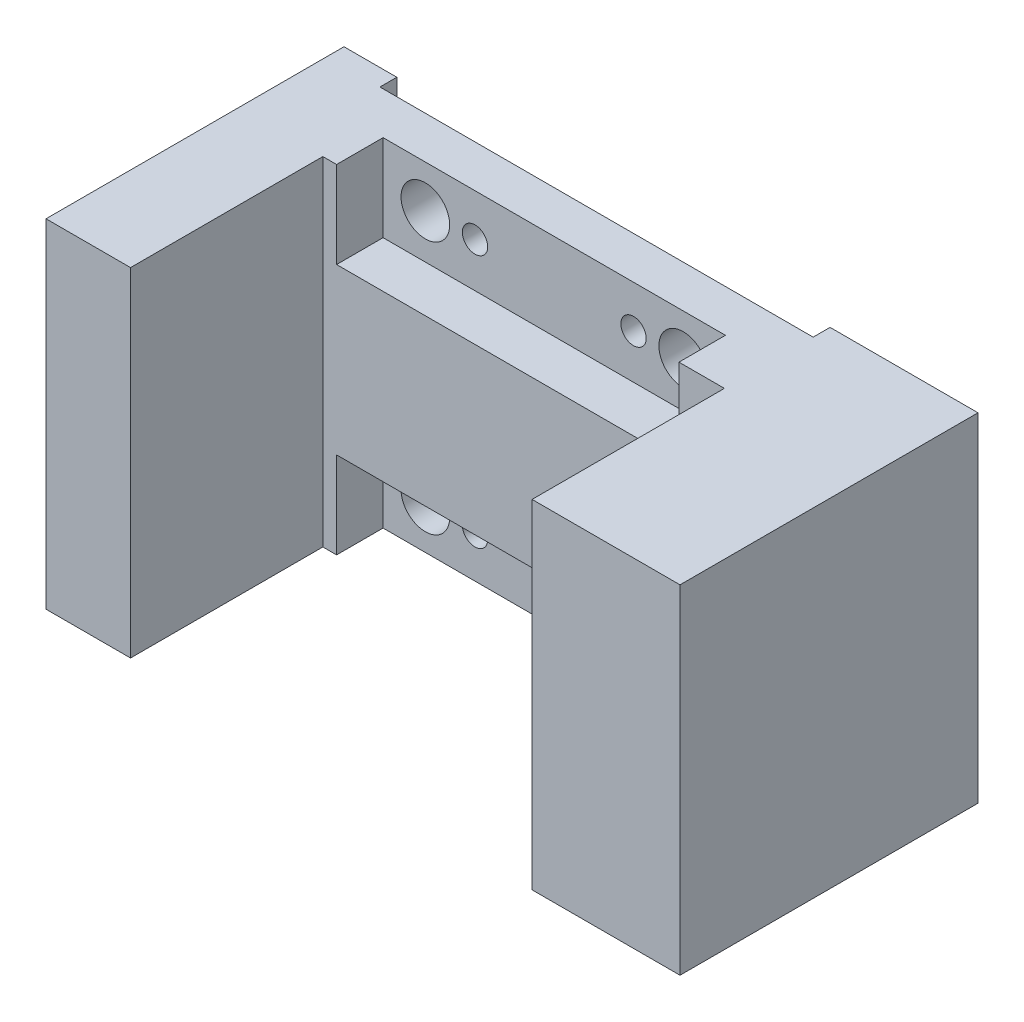
from build123d import *

# Parameters (mm, degrees)
SKETCH_1_W           = 30
SKETCH_1_H           = 28
EXTRUDE_1_DEPTH      = 10
CUT_EXTRUDE_2_DEPTH  = 0.8
M1_4X0_3_2_D         = 1.1
M1_4X0_3_2_DEPTH     = 3.7
M1_4X0_3_2_TIP       = 0.33047334
SKETCH_12_W          = 30
SKETCH_12_H          = 4.25
CUT_EXTRUDE_5_DEPTH  = 10
SKETCH_14_W          = 23
SKETCH_14_H          = 23.75
CUT_EXTRUDE_7_DEPTH  = 5
SKETCH_23_W          = 4
SKETCH_23_H          = 23.75
EXTRUDE_4_DEPTH      = 9.1
SKETCH_31_W          = 7
SKETCH_31_H          = 23.75
EXTRUDE_6_DEPTH      = 4.1
SKETCH_32_W          = 30
SKETCH_32_H          = 7.75
CUT_EXTRUDE_13_DEPTH = 20
SKETCH_33_W          = 3
SKETCH_33_H          = 0.8
CUT_EXTRUDE_14_DEPTH = 10
SKETCH_24_W          = 16.2
SKETCH_24_H          = 4.1
CUT_EXTRUDE_10_DEPTH = 5
SKETCH_29_W          = 16.2
SKETCH_29_H          = 2
EXTRUDE_5_DEPTH      = 4.1
SKETCH_35_W          = 16.2
SKETCH_35_H          = 2
EXTRUDE_7_DEPTH      = 4.1
SKETCH_30_R          = 1.15
SKETCH_30_R_2        = 0.6
CUT_EXTRUDE_12_DEPTH = 5


with BuildPart() as part:
    # 草图1 → 凸台-拉伸1 (new body)
    with BuildSketch(Plane.XY):
        with Locations((7.449728974, 2.736434109)):
            Rectangle(SKETCH_1_W, SKETCH_1_H)
    extrude(amount=EXTRUDE_1_DEPTH)

    # 草图2 → 切除-拉伸2 (cut)
    with BuildSketch(Plane(origin=(0, 0, 0), x_dir=(-1, 0, 0), z_dir=(0, 0, -1))):
        with BuildLine():
            Line((5.050271026, 16.736434109), (-15.449728974, 16.736434109))
            Line((-15.449728974, 16.736434109), (-15.449728974, 3.736434109))
            ThreePointArc((-15.449728974, 3.736434109), (-14.571049317, 1.615113765), (-12.449728974, 0.736434109))
            Line((-12.449728974, 0.736434109), (2.050271026, 0.736434109))
            ThreePointArc((2.050271026, 0.736434109), (4.17159137, 1.615113765), (5.050271026, 3.736434109))
            Line((5.050271026, 3.736434109), (5.050271026, 16.736434109))
        make_face()
    extrude(amount=-CUT_EXTRUDE_2_DEPTH, mode=Mode.SUBTRACT)

    # M1.4x0.3 螺纹孔2
    with Locations(Plane(origin=(0, 0, 0.8), x_dir=(-1, 0, 0), z_dir=(0, 0, -1))):
        with Locations((-12.199728974, 8.736434109), (1.800271026, 8.736434109)):
            Hole(M1_4X0_3_2_D / 2, depth=M1_4X0_3_2_DEPTH)
            with Locations((0, 0, -(M1_4X0_3_2_DEPTH + M1_4X0_3_2_TIP / 2))):  # 118° drill point
                Cone(0, M1_4X0_3_2_D / 2, M1_4X0_3_2_TIP, mode=Mode.SUBTRACT)

    # 草图12 → 切除-拉伸5 (cut)
    with BuildSketch(Plane(origin=(0, 0, 0), x_dir=(-1, 0, 0), z_dir=(0, 0, -1))):
        with Locations((-7.449728974, -9.138565891)):
            Rectangle(SKETCH_12_W, SKETCH_12_H)
    extrude(amount=-CUT_EXTRUDE_5_DEPTH, mode=Mode.SUBTRACT)

    # 草图14 → 切除-拉伸7 (cut)
    with BuildSketch(Plane.XY.offset(10)):
        with Locations((3.949728974, 4.861434109)):
            Rectangle(SKETCH_14_W, SKETCH_14_H)
    extrude(amount=-CUT_EXTRUDE_7_DEPTH, mode=Mode.SUBTRACT)

    # 草图23 → 凸台-拉伸4 (add)
    with BuildSketch(Plane.XY.offset(5)):
        with Locations((-5.550271026, 4.861434109)):
            Rectangle(SKETCH_23_W, SKETCH_23_H)
    extrude(amount=EXTRUDE_4_DEPTH)

    # 草图31 → 凸台-拉伸6 (add)
    with BuildSketch(Plane.XY.offset(10)):
        with Locations((18.949728974, 4.861434109)):
            Rectangle(SKETCH_31_W, SKETCH_31_H)
    extrude(amount=EXTRUDE_6_DEPTH)

    # 草图32 → 切除-拉伸13 (cut)
    with BuildSketch(Plane(origin=(0, 0, 0), x_dir=(-1, 0, 0), z_dir=(0, 0, -1))):
        with Locations((-7.449728974, -3.138565891)):
            Rectangle(SKETCH_32_W, SKETCH_32_H)
    extrude(amount=-CUT_EXTRUDE_13_DEPTH, mode=Mode.SUBTRACT)

    # 草图33 → 切除-拉伸14 (cut)
    with BuildSketch(Plane.XZ.offset(-0.736434109)):
        with Locations((-3.550271026, 0.4)):
            Rectangle(SKETCH_33_W, SKETCH_33_H)
        with Locations((13.949728974, 0.4)):
            Rectangle(SKETCH_33_W, SKETCH_33_H)
    extrude(amount=-CUT_EXTRUDE_14_DEPTH, mode=Mode.SUBTRACT)

    # 草图24 → 切除-拉伸10 (cut)
    with BuildSketch(Plane(origin=(0, 0, 0.8), x_dir=(-1, 0, 0), z_dir=(0, 0, -1))):
        with Locations((-5.199728974, 14.686434109)):
            Rectangle(SKETCH_24_W, SKETCH_24_H)
        with Locations((-5.199728974, 2.786434109)):
            Rectangle(SKETCH_24_W, SKETCH_24_H)
    extrude(amount=-CUT_EXTRUDE_10_DEPTH, mode=Mode.SUBTRACT)

    # 草图29 → 凸台-拉伸5 (add)
    with BuildSketch(Plane(origin=(0, 12.636434109, 0), x_dir=(1, 0, 0), z_dir=(0, 1, 0))):
        with Locations((5.199728974, -1.8)):
            Rectangle(SKETCH_29_W, SKETCH_29_H)
    extrude(amount=EXTRUDE_5_DEPTH)

    # 草图35 → 凸台-拉伸7 (add)
    with BuildSketch(Plane.XZ.offset(-4.836434109)):
        with Locations((5.199728974, 1.8)):
            Rectangle(SKETCH_35_W, SKETCH_35_H)
    extrude(amount=EXTRUDE_7_DEPTH)

    # 草图30 → 切除-拉伸12 (cut)
    with BuildSketch(Plane(origin=(0, 0, 0.8), x_dir=(-1, 0, 0), z_dir=(0, 0, -1))):
        with Locations((0.900271026, 14.736434109)):
            Circle(SKETCH_30_R)
        with Locations((-11.299728974, 14.736434109)):
            Circle(SKETCH_30_R)
        with Locations((-8.949728974, 2.736434109)):
            Circle(SKETCH_30_R_2)
        with Locations((-1.449728974, 14.736434109)):
            Circle(SKETCH_30_R_2)
        with Locations((-8.949728974, 14.736434109)):
            Circle(SKETCH_30_R_2)
        with Locations((-1.449728974, 2.736434109)):
            Circle(SKETCH_30_R_2)
        with Locations((-11.299728974, 2.736434109)):
            Circle(SKETCH_30_R)
        with Locations((0.900271026, 2.736434109)):
            Circle(SKETCH_30_R)
    extrude(amount=-CUT_EXTRUDE_12_DEPTH, mode=Mode.SUBTRACT)


solid = part.part
